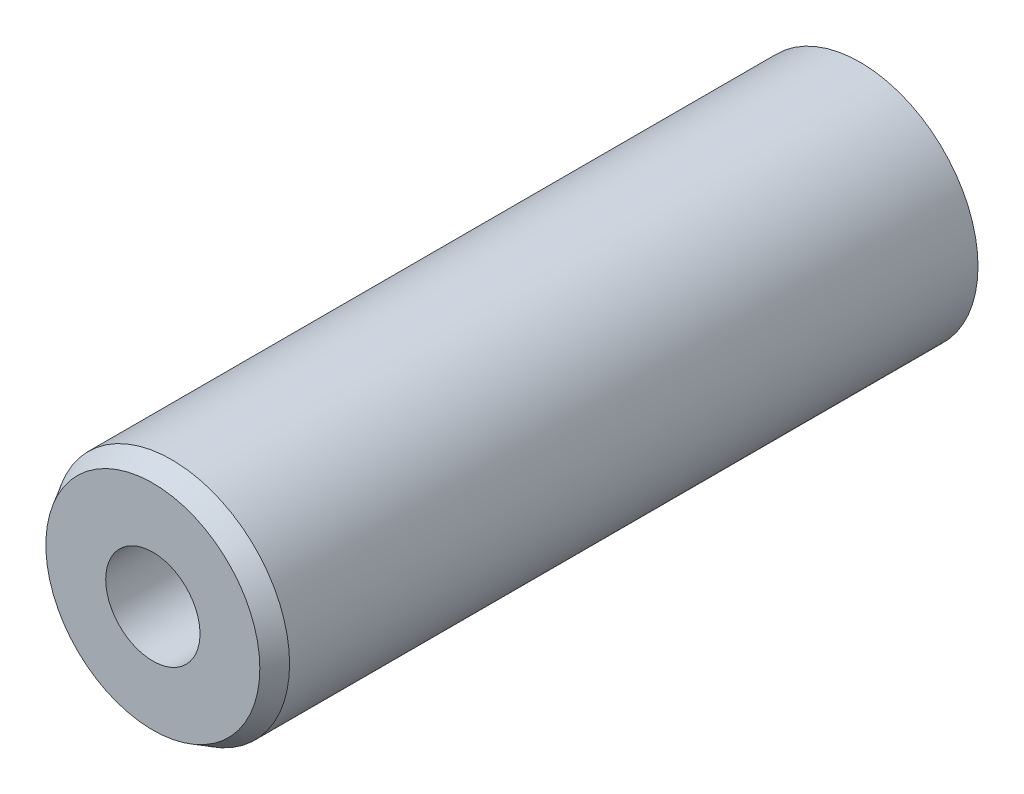
from build123d import *

# Parameters (mm, degrees)
SKETCH1_R                       = 2.5
BOSS_EXTRUDE1_DEPTH             = 15
SKETCH2_R                       = 1
CUT_EXTRUDE1_DEPTH              = 16.411035007
TAP_DRILL_FOR_M4X0_7_TAP1_D     = 3.3
TAP_DRILL_FOR_M4X0_7_TAP1_DEPTH = 11
TAP_DRILL_FOR_M4X0_7_TAP1_TIP   = 0.991420021
CHAMFER1_SIZE                   = 0.4
CHAMFER1_SIZE2                  = 0.230940108
CHAMFER2_SIZE                   = 0.5
CHAMFER2_SIZE2                  = 0.866025404


with BuildPart() as part:
    # Sketch1 → Boss-Extrude1 (new body)
    with BuildSketch(Plane.XY):
        Circle(SKETCH1_R)
    extrude(amount=BOSS_EXTRUDE1_DEPTH)

    # Sketch2 → Cut-Extrude1 (cut, through all)
    with BuildSketch(Plane(origin=(0, 0, 0), x_dir=(-1, 0, 0), z_dir=(0, 0, -1))):
        Circle(SKETCH2_R)
    extrude(amount=-CUT_EXTRUDE1_DEPTH, mode=Mode.SUBTRACT)

    # Tap Drill for M4x0.7 Tap1
    with Locations(Plane(origin=(0, 0, 0), x_dir=(-1, 0, 0), z_dir=(0, 0, -1))):
        with Locations((0, 0)):
            Hole(TAP_DRILL_FOR_M4X0_7_TAP1_D / 2, depth=TAP_DRILL_FOR_M4X0_7_TAP1_DEPTH)
            with Locations((0, 0, -(TAP_DRILL_FOR_M4X0_7_TAP1_DEPTH + TAP_DRILL_FOR_M4X0_7_TAP1_TIP / 2))):  # 118° drill point
                Cone(0, TAP_DRILL_FOR_M4X0_7_TAP1_D / 2, TAP_DRILL_FOR_M4X0_7_TAP1_TIP, mode=Mode.SUBTRACT)

    # Chamfer1
    chamfer1_edges = [part.edges().sort_by_distance(p)[0] for p in [
        (-2.5, 0, 15),
    ]]
    chamfer1_side = [part.faces().sort_by_distance(p)[0] for p in [
        (-2.5, 0, 7.5),
    ]]
    chamfer(chamfer1_edges, length=CHAMFER1_SIZE, length2=CHAMFER1_SIZE2, reference=chamfer1_side[0])

    # Chamfer2
    chamfer2_edges = [part.edges().sort_by_distance(p)[0] for p in [
        (-1.65, 0, 0),
    ]]
    chamfer2_side = [part.faces().sort_by_distance(p)[0] for p in [
        (-2.429289322, 0, 0),
    ]]
    chamfer(chamfer2_edges, length=CHAMFER2_SIZE, length2=CHAMFER2_SIZE2, reference=chamfer2_side[0])


solid = part.part
